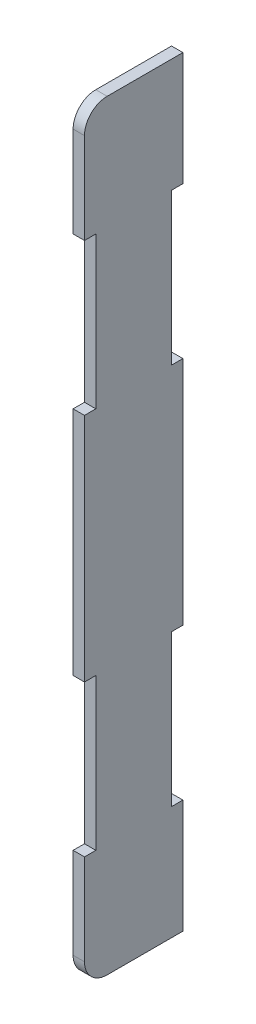
from build123d import *

# Parameters (mm, degrees)
SKETCH_1_W          = 26
SKETCH_1_H          = 201
EXTRUDE_1_DEPTH     = 3
SKETCH_2_W          = 3
SKETCH_2_H          = 40
CUT_EXTRUDE_1_DEPTH = 3
FILLET_2_R          = 6
FILLET_3_R          = 6


with BuildPart() as part:
    # 草图1 → 凸台-拉伸1 (new body)
    with BuildSketch(Plane(origin=(0, 0, 0), x_dir=(0, 0, -1), z_dir=(1, 0, 0))):
        with Locations((-7.432605804, -18.101046442)):
            Rectangle(SKETCH_1_W, SKETCH_1_H)
    extrude(amount=EXTRUDE_1_DEPTH)

    # 草图2 → 切除-拉伸1 (cut)
    with BuildSketch(Plane(origin=(0, 0, 0), x_dir=(0, 0, -1), z_dir=(1, 0, 0))):
        with Locations((4.067394196, -68.601046442)):
            Rectangle(SKETCH_2_W, SKETCH_2_H)
        with Locations((-18.932605804, -68.601046442)):
            Rectangle(SKETCH_2_W, SKETCH_2_H)
        with Locations((-18.932605804, 32.398953558)):
            Rectangle(SKETCH_2_W, SKETCH_2_H)
        with Locations((4.067394196, 32.398953558)):
            Rectangle(SKETCH_2_W, SKETCH_2_H)
    extrude(amount=CUT_EXTRUDE_1_DEPTH, mode=Mode.SUBTRACT)

    # 圆角2
    fillet_2_edges = [part.edges().sort_by_distance(p)[0] for p in [
        (1.5, -118.601046442, 20.432605804),
    ]]
    fillet(fillet_2_edges, radius=FILLET_2_R)

    # 圆角3
    fillet_3_edges = [part.edges().sort_by_distance(p)[0] for p in [
        (1.5, 82.398953558, 20.432605804),
    ]]
    fillet(fillet_3_edges, radius=FILLET_3_R)


solid = part.part
